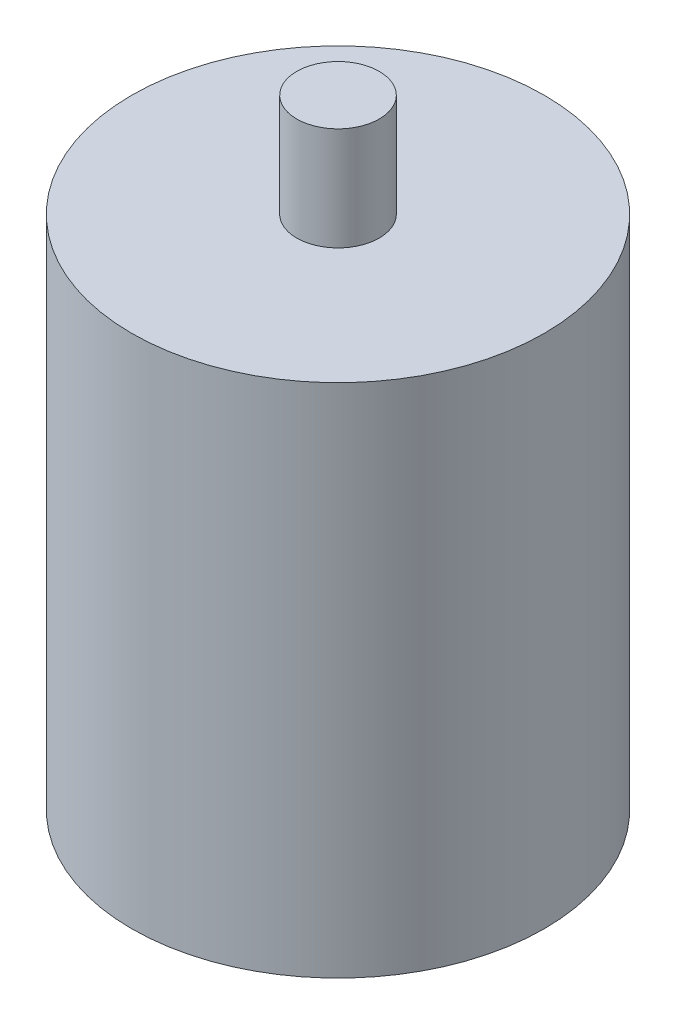
from build123d import *

# Parameters (mm, degrees)
SKETCH_3_R      = 20
EXTRUDE_3_DEPTH = 50
SKETCH_4_R      = 3
EXTRUDE_4_DEPTH = 5
SKETCH_5_R      = 4
EXTRUDE_5_DEPTH = 10


with BuildPart() as part:
    # 草图3 → 凸台-拉伸3 (new body)
    with BuildSketch(Plane(origin=(0, 0, 0), x_dir=(1, 0, 0), z_dir=(0, 1, 0))):
        with Locations(Location((0, 0, 0), (0, 0, 270))):
            Circle(SKETCH_3_R)
    extrude(amount=EXTRUDE_3_DEPTH)

    # 草图4 → 凸台-拉伸4 (add)
    with BuildSketch(Plane.XZ):
        with Locations(Location((0, 0, 0), (0, 0, 270))):
            Circle(SKETCH_4_R)
    extrude(amount=EXTRUDE_4_DEPTH)

    # 草图5 → 凸台-拉伸5 (add)
    with BuildSketch(Plane(origin=(0, 50, 0), x_dir=(1, 0, 0), z_dir=(0, 1, 0))):
        with Locations(Location((0, 0, 0), (0, 0, 270))):
            Circle(SKETCH_5_R)
    extrude(amount=EXTRUDE_5_DEPTH)


solid = part.part
